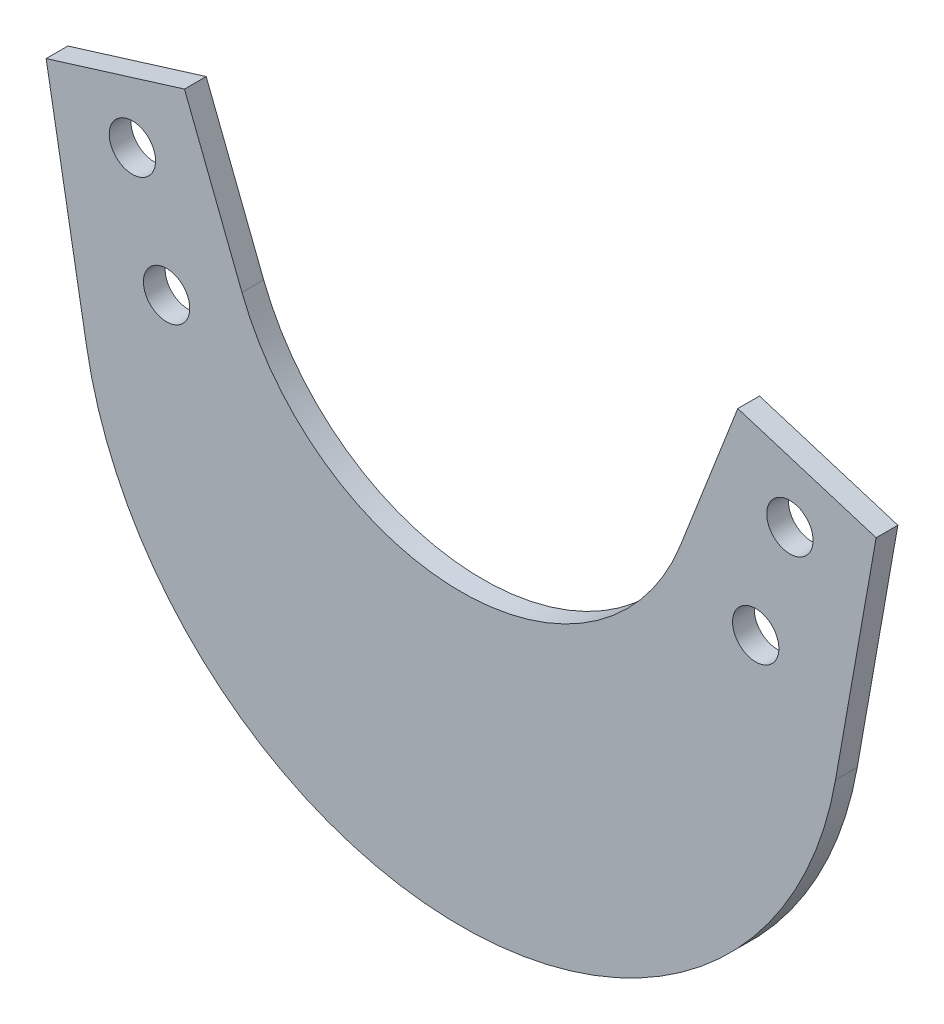
from build123d import *

# Parameters (mm, degrees)
SKETCH1_R           = 1.6
BOSS_EXTRUDE1_DEPTH = 1.5


with BuildPart() as part:
    # Sketch1 → Boss-Extrude1 (new body)
    with BuildSketch(Plane.XY):
        with BuildLine():
            Line((25.85974293, -14.554976912), (28.663386119, 1.32487132))
            Line((28.663386119, 1.32487132), (19.108746057, 4.275947949))
            Line((19.108746057, 4.275947949), (15.138453004, -5.904104582))
            ThreePointArc((15.138453004, -5.904104582), (0, -16.249037211), (-15.138453004, -5.904104582))
            Line((-15.138453004, -5.904104582), (-19.108746057, 4.275947949))
            Line((-19.108746057, 4.275947949), (-28.663386119, 1.32487132))
            Line((-28.663386119, 1.32487132), (-25.85974293, -14.554976912))
            ThreePointArc((-25.85974293, -14.554976912), (0, -36.249037211), (25.85974293, -14.554976912))
        make_face()
        with Locations(Location((-20.344774133, -8.665158441, 0), (0, 0, 180))):
            Circle(SKETCH1_R, mode=Mode.SUBTRACT)
        with Locations(Location((-22.705635436, -1.021446391, 0), (0, 0, 180))):
            Circle(SKETCH1_R, mode=Mode.SUBTRACT)
        with Locations((22.705635436, -1.021446391)):
            Circle(SKETCH1_R, mode=Mode.SUBTRACT)
        with Locations((20.344774133, -8.665158441)):
            Circle(SKETCH1_R, mode=Mode.SUBTRACT)
    extrude(amount=BOSS_EXTRUDE1_DEPTH)


solid = part.part
